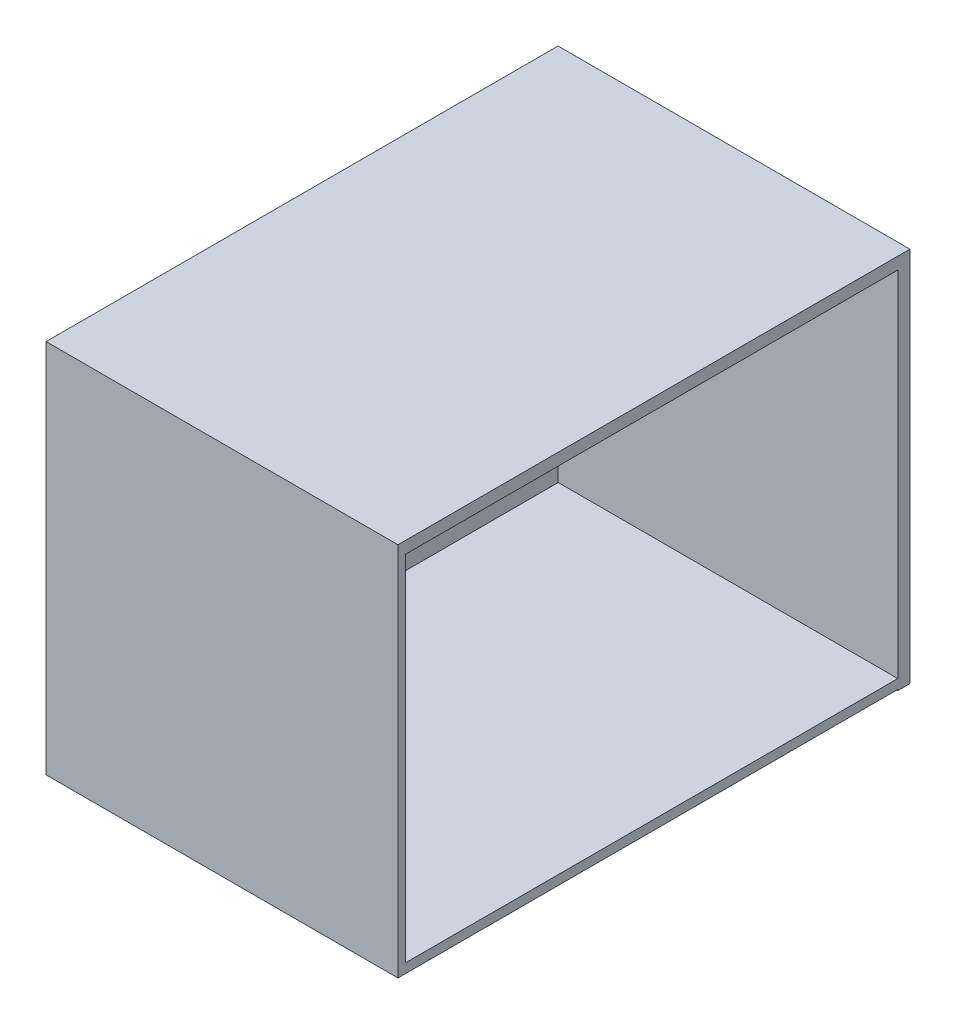
from build123d import *

# Parameters (mm, degrees)
SKETCH1_W           = 82.927984002
SKETCH1_H           = 60.776462656
BOSS_EXTRUDE1_DEPTH = 2
SKETCH2_W           = 82.927984002
SKETCH2_H           = 1.944543981
BOSS_EXTRUDE2_DEPTH = 55
SKETCH3_W           = 82.927984002
SKETCH3_H           = 1.52283727
BOSS_EXTRUDE3_DEPTH = 55
SKETCH4_W           = 1.238263506
SKETCH4_H           = 57.309081405
BOSS_EXTRUDE4_DEPTH = 55
SKETCH5_W           = 55
SKETCH5_H           = 1.968247646
BOSS_EXTRUDE5_DEPTH = 59
SKETCH6_W           = 41.500434797
SKETCH6_H           = 30.602093287
CUT_EXTRUDE1_DEPTH  = 59


with BuildPart() as part:
    # Sketch1 → Boss-Extrude1 (new body)
    with BuildSketch(Plane(origin=(0, 0, 0), x_dir=(0, 0, -1), z_dir=(1, 0, 0))):
        with Locations((-67.649308223, 21.107365524)):
            Rectangle(SKETCH1_W, SKETCH1_H)
    extrude(amount=BOSS_EXTRUDE1_DEPTH)

    # Sketch2 → Boss-Extrude2 (add)
    with BuildSketch(Plane(origin=(2, 0, 0), x_dir=(0, 0, -1), z_dir=(1, 0, 0))):
        with Locations((-67.649308223, 50.523324862)):
            Rectangle(SKETCH2_W, SKETCH2_H)
    extrude(amount=BOSS_EXTRUDE2_DEPTH)

    # Sketch3 → Boss-Extrude3 (add)
    with BuildSketch(Plane(origin=(2, 0, 0), x_dir=(0, 0, -1), z_dir=(1, 0, 0))):
        with Locations((-67.649308223, -8.519447169)):
            Rectangle(SKETCH3_W, SKETCH3_H)
    extrude(amount=BOSS_EXTRUDE3_DEPTH)

    # Sketch4 → Boss-Extrude4 (add)
    with BuildSketch(Plane(origin=(2, 0, 0), x_dir=(0, 0, -1), z_dir=(1, 0, 0))):
        with Locations((-108.494168471, 20.896512169)):
            Rectangle(SKETCH4_W, SKETCH4_H)
    extrude(amount=BOSS_EXTRUDE4_DEPTH)

    # Sketch5 → Boss-Extrude5 (add)
    with BuildSketch(Plane(origin=(0, 49.551052871, 0), x_dir=(-1, 0, 0), z_dir=(0, -1, 0))):
        with Locations((-29.5, -27.169440045)):
            Rectangle(SKETCH5_W, SKETCH5_H)
    extrude(amount=BOSS_EXTRUDE5_DEPTH)

    # Sketch6 → Cut-Extrude1 (cut)
    with BuildSketch(Plane.ZY):
        with Locations((77.408781478, 14.741773436)):
            Rectangle(SKETCH6_W, SKETCH6_H)
    extrude(amount=-CUT_EXTRUDE1_DEPTH, mode=Mode.SUBTRACT)


solid = part.part
